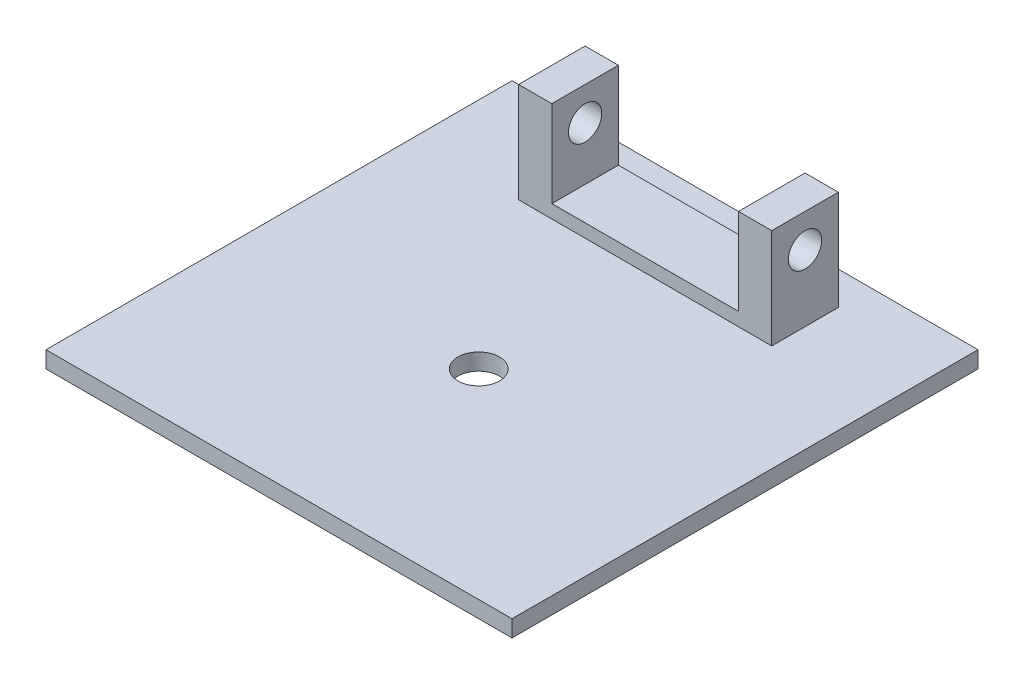
from build123d import *

# Parameters (mm, degrees)
SKETCH1_W           = 177.8
SKETCH1_H           = 177.8
BOSS_EXTRUDE1_DEPTH = 6.35
SKETCH2_R           = 7.9375
CUT_EXTRUDE1_DEPTH  = 126.88384527
SKETCH3_W           = 96.606953724
SKETCH3_H           = 25.4
BOSS_EXTRUDE2_DEPTH = 38.1
CUT_EXTRUDE2_REACH  = 194.71
SKETCH4_W           = 71.206953724
SKETCH4_H           = 33.02
SKETCH5_R           = 6.35
CUT_EXTRUDE3_DEPTH  = 170.421977804


with BuildPart() as part:
    # Sketch1 → Boss-Extrude1 (new body)
    with BuildSketch(Plane(origin=(0, 0, 0), x_dir=(1, 0, 0), z_dir=(0, 1, 0))):
        Rectangle(SKETCH1_W, SKETCH1_H)
    extrude(amount=BOSS_EXTRUDE1_DEPTH)

    # Sketch2 → Cut-Extrude1 (cut, through all)
    with BuildSketch(Plane(origin=(0, 6.35, 0), x_dir=(1, 0, 0), z_dir=(0, 1, 0))):
        with Locations(Location((0, -12.7, 0), (0, 0, 270))):
            Circle(SKETCH2_R)
    extrude(amount=-CUT_EXTRUDE1_DEPTH, mode=Mode.SUBTRACT)

    # Sketch3 → Boss-Extrude2 (add)
    with BuildSketch(Plane(origin=(0, 6.35, 0), x_dir=(1, 0, 0), z_dir=(0, 1, 0))):
        with Locations((0, 63.5)):
            Rectangle(SKETCH3_W, SKETCH3_H)
    extrude(amount=BOSS_EXTRUDE2_DEPTH)

    # Sketch4 → Cut-Extrude2 (cut, up to next)
    with BuildSketch(Plane(origin=(0, 0, -76.2), x_dir=(-1, 0, 0), z_dir=(0, 0, -1)), mode=Mode.PRIVATE) as cut_extrude2_sk1:
        with Locations((0, 27.94)):
            Rectangle(SKETCH4_W, SKETCH4_H)
    cut_extrude2_tool1 = extrude(cut_extrude2_sk1.sketch, amount=-CUT_EXTRUDE2_REACH, mode=Mode.PRIVATE) & part.part
    add(cut_extrude2_tool1.solids().sort_by_distance((0, 27.94, -76.2))[0], mode=Mode.SUBTRACT)

    # Sketch5 → Cut-Extrude3 (cut, through all)
    with BuildSketch(Plane.ZY.offset(48.303476862)):
        with Locations((-63.5, 31.75)):
            Circle(SKETCH5_R)
    extrude(amount=-CUT_EXTRUDE3_DEPTH, mode=Mode.SUBTRACT)


solid = part.part
